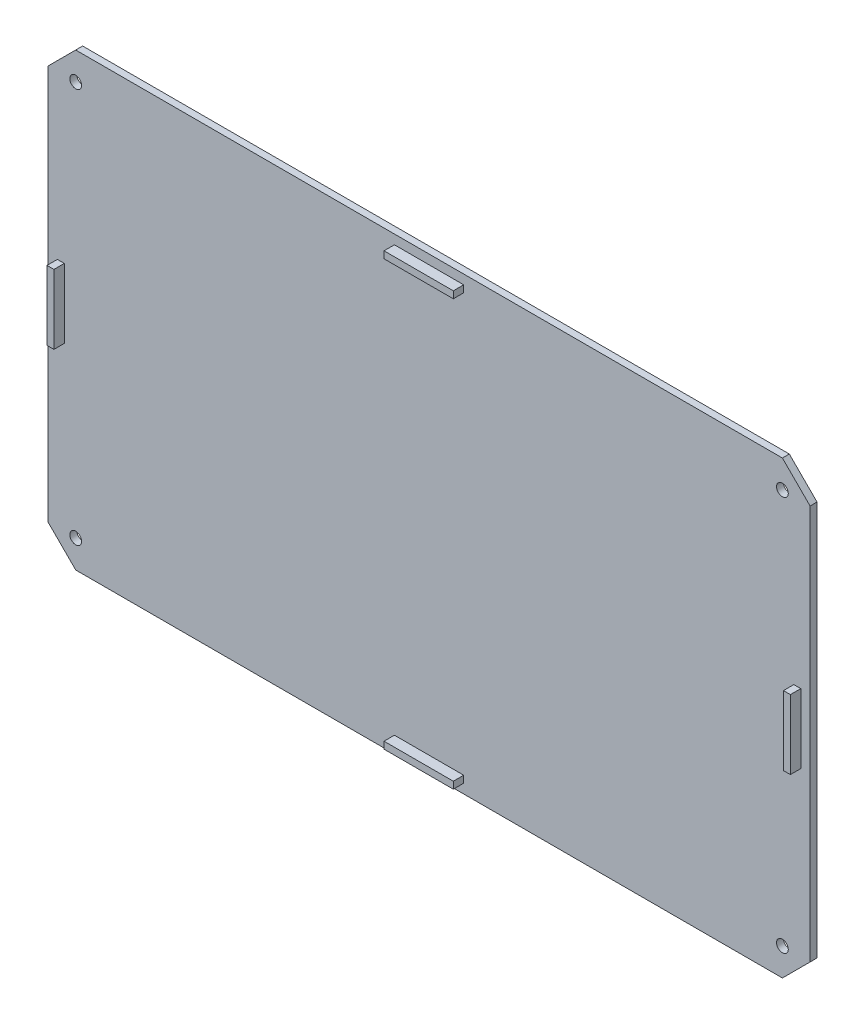
from build123d import *

# Parameters (mm, degrees)
FACETED_REMOVABLE_LID_DEPTH  = 2
SIDE_LOCATOR_1_START         = 2
SKETCH2_W                    = 20
SKETCH2_H                    = 2
SIDE_LOCATOR_1_DEPTH         = 3
END_LOCATOR_1_START          = 2
SKETCH3_W                    = 2
SKETCH3_H                    = 20
END_LOCATOR_1_DEPTH          = 3
SKETCH4_W                    = 20
SKETCH4_H                    = 2
SIDE_LOCATOR_1_2_DEPTH       = 3
SKETCH5_W                    = 2
SKETCH5_H                    = 20
END_LOCATOR_1_2_DEPTH        = 3
M3_LID_CLEARANCE_1_1_START   = -0.1
SKETCH6_R                    = 1.7
M3_LID_CLEARANCE_1_1_DEPTH   = 2.2
SKETCH7_R                    = 1.7
M3_LID_CLEARANCE_1_1_2_DEPTH = 2.2
SKETCH8_R                    = 1.7
M3_LID_CLEARANCE_1_1_3_DEPTH = 2.2
SKETCH9_R                    = 1.7
M3_LID_CLEARANCE_1_1_4_DEPTH = 2.2


with BuildPart() as part:
    # Sketch1 → Faceted_Removable_Lid (new body)
    with BuildSketch(Plane.XY):
        Polygon((-102, -65), (102, -65), (110, -57), (110, 57), (102, 65), (-102, 65), (-110, 57), (-110, -57), align=None)
    extrude(amount=FACETED_REMOVABLE_LID_DEPTH)

    # Sketch2 → Side_Locator_-1 (add)
    with BuildSketch(Plane.XY.offset(SIDE_LOCATOR_1_START)):
        with Locations((0, -61.3)):
            Rectangle(SKETCH2_W, SKETCH2_H)
    extrude(amount=SIDE_LOCATOR_1_DEPTH)

    # Sketch3 → End_Locator_-1 (add)
    with BuildSketch(Plane.XY.offset(END_LOCATOR_1_START)):
        with Locations((-106.3, 0)):
            Rectangle(SKETCH3_W, SKETCH3_H)
    extrude(amount=END_LOCATOR_1_DEPTH)

    # Sketch4 → Side_Locator_1 2 (add)
    with BuildSketch(Plane.XY.offset(SIDE_LOCATOR_1_START)):
        with Locations((0, 61.3)):
            Rectangle(SKETCH4_W, SKETCH4_H)
    extrude(amount=SIDE_LOCATOR_1_2_DEPTH)

    # Sketch5 → End_Locator_1 2 (add)
    with BuildSketch(Plane.XY.offset(END_LOCATOR_1_START)):
        with Locations((106.3, 0)):
            Rectangle(SKETCH5_W, SKETCH5_H)
    extrude(amount=END_LOCATOR_1_2_DEPTH)

    # Sketch6 → M3_Lid_Clearance_-1_-1 (cut)
    with BuildSketch(Plane.XY.offset(M3_LID_CLEARANCE_1_1_START)):
        with Locations((-102, -57)):
            Circle(SKETCH6_R)
    extrude(amount=M3_LID_CLEARANCE_1_1_DEPTH, mode=Mode.SUBTRACT)

    # Sketch7 → M3_Lid_Clearance_-1_1 2 (cut)
    with BuildSketch(Plane.XY.offset(M3_LID_CLEARANCE_1_1_START)):
        with Locations((-102, 57)):
            Circle(SKETCH7_R)
    extrude(amount=M3_LID_CLEARANCE_1_1_2_DEPTH, mode=Mode.SUBTRACT)

    # Sketch8 → M3_Lid_Clearance_1_-1 3 (cut)
    with BuildSketch(Plane.XY.offset(M3_LID_CLEARANCE_1_1_START)):
        with Locations((102, -57)):
            Circle(SKETCH8_R)
    extrude(amount=M3_LID_CLEARANCE_1_1_3_DEPTH, mode=Mode.SUBTRACT)

    # Sketch9 → M3_Lid_Clearance_1_1 4 (cut)
    with BuildSketch(Plane.XY.offset(M3_LID_CLEARANCE_1_1_START)):
        with Locations((102, 57)):
            Circle(SKETCH9_R)
    extrude(amount=M3_LID_CLEARANCE_1_1_4_DEPTH, mode=Mode.SUBTRACT)


solid = part.part
